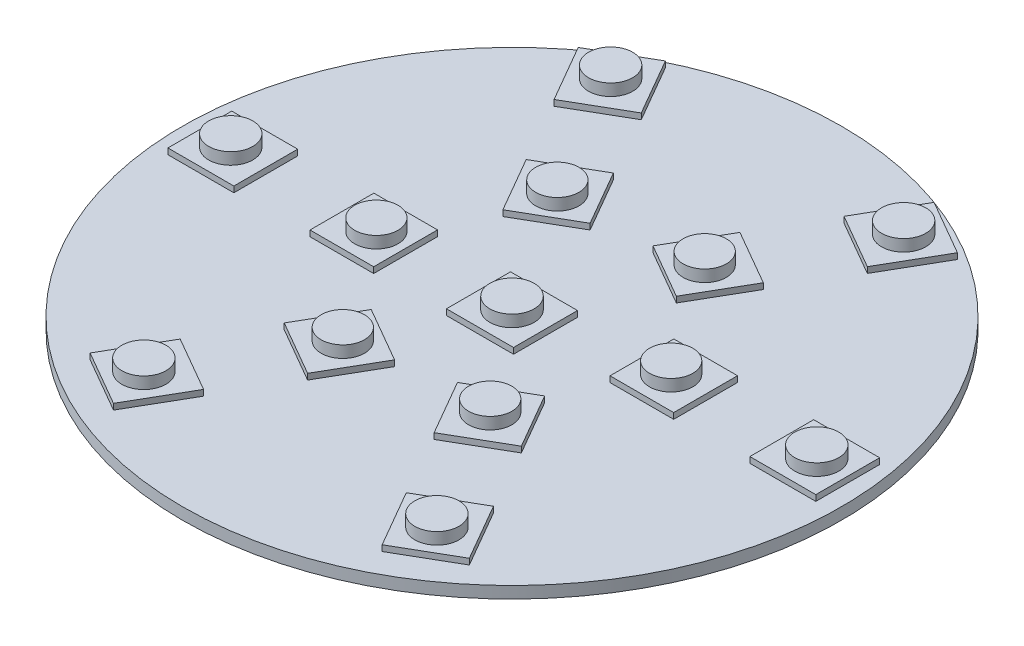
from build123d import *

# Parameters (mm, degrees)
SKETCH1_R           = 28
BOSS_EXTRUDE1_DEPTH = 1
SKETCH2_W           = 5.602179168
SKETCH2_H           = 5.423853163
SKETCH2_W_2         = 5.409000575
SKETCH2_W_3         = 5.69543838
SKETCH2_H_2         = 5.43870575
BOSS_EXTRUDE3_DEPTH = 0.5
SKETCH3_R           = 1.87600115
SKETCH3_R_2         = 1.841544929
SKETCH3_R_3         = 1.880605589
BOSS_EXTRUDE4_DEPTH = 1


with BuildPart() as part:
    # Sketch1 → Boss-Extrude1 (new body)
    with BuildSketch(Plane(origin=(0, 0, 0), x_dir=(1, 0, 0), z_dir=(0, 1, 0))):
        with Locations(Location((0, 0, 0), (0, 0, 270))):
            Circle(SKETCH1_R)
    extrude(amount=BOSS_EXTRUDE1_DEPTH)

    # Sketch2 → Boss-Extrude3 (add)
    with BuildSketch(Plane(origin=(0, 1, 0), x_dir=(1, 0, 0), z_dir=(0, 1, 0))):
        Polygon((-8.980483261, 19.96365386), (-13.677677887, 17.251727279), (-16.47876747, 22.103356754), (-11.781572845, 24.815283336), align=None)
        with Locations((-23.714337206, -0.007426294)):
            Rectangle(SKETCH2_W, SKETCH2_H)
        with Locations((-11.737264504, -0.007426294)):
            Rectangle(SKETCH2_W_2, SKETCH2_H)
        Rectangle(SKETCH2_W_3, SKETCH2_H_2)
        Polygon((-10.441936471, 11.647258747), (-7.737436184, 6.96292684), (-3.040241558, 9.674853421), (-5.744741846, 14.359185329), align=None)
        Polygon((11.932764361, 18.259153573), (7.235569736, 20.971080154), (10.036659319, 25.82270963), (14.733853945, 23.110783048), align=None)
        Polygon((3.99982832, 15.366611623), (1.295328032, 10.682279715), (5.992522658, 7.970353134), (8.697022946, 12.654685041), align=None)
        with Locations((23.714337206, 2.007426294)):
            Rectangle(SKETCH2_W, SKETCH2_H)
        with Locations((11.737264504, 2.007426294)):
            Rectangle(SKETCH2_W_2, SKETCH2_H)
        Polygon((8.980483261, -17.96365386), (13.677677887, -15.251727279), (16.47876747, -20.103356754), (11.781572845, -22.815283336), align=None)
        Polygon((10.441936471, -9.647258747), (7.737436184, -4.96292684), (3.040241558, -7.674853421), (5.744741846, -12.359185329), align=None)
        Polygon((-11.932764361, -16.259153573), (-7.235569736, -18.971080154), (-10.036659319, -23.82270963), (-14.733853945, -21.110783048), align=None)
        Polygon((-3.99982832, -13.366611623), (-1.295328032, -8.682279715), (-5.992522658, -5.970353134), (-8.697022946, -10.654685041), align=None)
    extrude(amount=BOSS_EXTRUDE3_DEPTH)

    # Sketch3 → Boss-Extrude4 (add)
    with BuildSketch(Plane(origin=(0, 1.5, 0), x_dir=(1, 0, 0), z_dir=(0, 1, 0))):
        with Locations(Location((-23.895356308, 0, 0), (0, 0, 270))):
            Circle(SKETCH3_R)
        with Locations(Location((-11.523163477, 0, 0), (0, 0, 270))):
            Circle(SKETCH3_R_2)
        with Locations(Location((0, 0, 0), (0, 0, 270))):
            Circle(SKETCH3_R_3)
        with Locations(Location((-12.813703558, 21.193985595, 0), (0, 0, 270))):
            Circle(SKETCH3_R)
        with Locations(Location((-6.627607142, 10.479352303, 0), (0, 0, 270))):
            Circle(SKETCH3_R_2)
        with Locations(Location((11.08165275, 22.193985595, 0), (0, 0, 270))):
            Circle(SKETCH3_R)
        with Locations(Location((4.895556335, 11.479352303, 0), (0, 0, 270))):
            Circle(SKETCH3_R_2)
        with Locations(Location((23.895356308, 2, 0), (0, 0, 270))):
            Circle(SKETCH3_R)
        with Locations(Location((11.523163477, 2, 0), (0, 0, 270))):
            Circle(SKETCH3_R_2)
        with Locations(Location((12.813703558, -19.193985595, 0), (0, 0, 270))):
            Circle(SKETCH3_R)
        with Locations(Location((6.627607142, -8.479352303, 0), (0, 0, 270))):
            Circle(SKETCH3_R_2)
        with Locations(Location((-11.08165275, -20.193985595, 0), (0, 0, 270))):
            Circle(SKETCH3_R)
        with Locations(Location((-4.895556335, -9.479352303, 0), (0, 0, 270))):
            Circle(SKETCH3_R_2)
    extrude(amount=BOSS_EXTRUDE4_DEPTH)


solid = part.part
